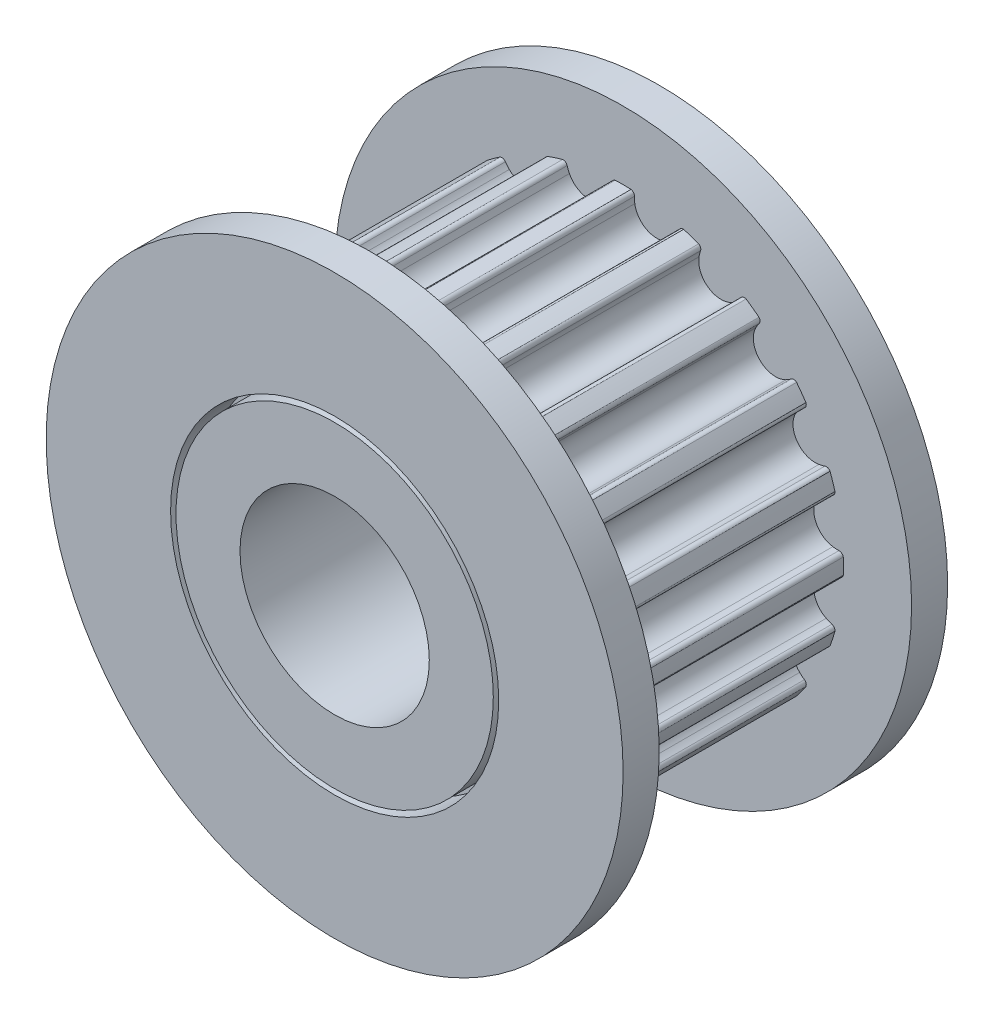
from build123d import *

# Parameters (mm, degrees)
CUT_EXTRUDE1_DEPTH  = 7
CIRPATTERN1_COUNT   = 20
CUT_EXTRUDE2_START  = -1
SKETCH7_R           = 8
SKETCH7_R_2         = 4.55
SKETCH7_R_3         = 4.4
CUT_EXTRUDE2_DEPTH  = 1
SKETCH7_3_R         = 8
SKETCH7_3_R_2       = 4.55
BOSS_EXTRUDE1_DEPTH = 1


with BuildPart() as part:
    # Sketch5 → Revolve1 (revolve)
    with BuildSketch(Plane(origin=(0, 0, 0), x_dir=(0, 0, -1), z_dir=(1, 0, 0)), mode=Mode.PRIVATE) as revolve1_sk:
        Polygon((0.5, 8), (0.5, 6.11), (7.5, 6.11), (7.5, 8), (8.5, 8), (8.5, 2.625), (-0.5, 2.625), (-0.5, 8), align=None)
    revolve(revolve1_sk.sketch.rotate(Axis((0, 0, 0), (0, 0, -1)), 90), axis=Axis((0, 0, 0), (0, 0, -1)))

    # Sketch6 → Cut-Extrude1 (cut)
    with BuildSketch(Plane.XY.offset(-0.5)):
        with BuildLine():
            Line((0, 6.112197724), (0, 6.366197724))
            ThreePointArc((0, 6.366197724), (0.996059721, 6.287792815), (1.967263286, 6.054613829))
            Line((1.967263286, 6.054613829), (1.88877297, 5.813045474))
            ThreePointArc((1.88877297, 5.813045474), (1.794613714, 5.842800924), (1.699986032, 5.871031298))
            ThreePointArc((1.699986032, 5.871031298), (1.60929489, 5.861193456), (1.551726022, 5.790429823))
            ThreePointArc((1.551726022, 5.790429823), (1.52370277, 5.709893157), (1.4890504, 5.63197865))
            ThreePointArc((1.4890504, 5.63197865), (0.838832532, 5.296180172), (0.324206028, 5.816471874))
            ThreePointArc((0.324206028, 5.816471874), (0.315326573, 5.901281145), (0.313562076, 5.986535727))
            ThreePointArc((0.313562076, 5.986535727), (0.280677993, 6.071625699), (0.197465653, 6.109007148))
            ThreePointArc((0.197465653, 6.109007148), (0.098745714, 6.111400028), (0, 6.112197724))
        make_face()
    cut_extrude1 = extrude(amount=-CUT_EXTRUDE1_DEPTH, mode=Mode.SUBTRACT)

    # CirPattern1: Cut-Extrude1 ×20 about axis
    cirpattern1_axis = Axis((0, 0, 0), (0, 0, 1))
    for i in range(1, CIRPATTERN1_COUNT):
        add(cut_extrude1.rotate(cirpattern1_axis, i * 360 / CIRPATTERN1_COUNT), mode=Mode.SUBTRACT)

    # Sketch7 → Cut-Extrude2 (cut)
    # profile 1 of 2: a face of its own
    with BuildSketch(Plane.XY.offset(0.5).offset(CUT_EXTRUDE2_START)):
        Circle(SKETCH7_R)
        Circle(SKETCH7_R_2, mode=Mode.SUBTRACT)
    # profile 2 of 2: a face of its own
    with BuildSketch(Plane.XY.offset(0.5).offset(CUT_EXTRUDE2_START)):
        Circle(SKETCH7_R_2)
        Circle(SKETCH7_R_3, mode=Mode.SUBTRACT)
    extrude(amount=CUT_EXTRUDE2_DEPTH, mode=Mode.SUBTRACT)


with BuildPart() as body_2:
    # Sketch7<3> → Boss-Extrude1 (new body)
    with BuildSketch(Plane.XY.offset(0.5)):
        Circle(SKETCH7_3_R)
        Circle(SKETCH7_3_R_2, mode=Mode.SUBTRACT)
    extrude(amount=-BOSS_EXTRUDE1_DEPTH)


solid = Compound([part.part, body_2.part])
